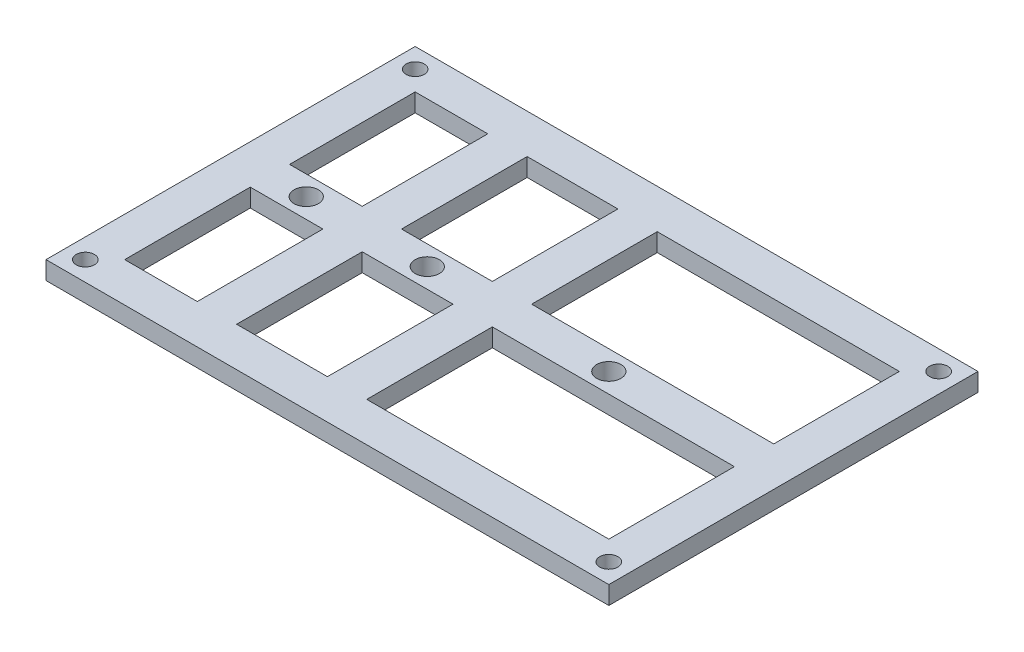
from build123d import *

# Parameters (mm, degrees)
SKETCH1_W           = 93
SKETCH1_H           = 61
SKETCH1_R           = 2
SKETCH1_R_2         = 1.5
SKETCH1_W_2         = 12
SKETCH1_H_2         = 20.75
SKETCH1_W_3         = 40
SKETCH1_W_4         = 15
BOSS_EXTRUDE1_DEPTH = 1.5


with BuildPart() as part:
    # Sketch1 → Boss-Extrude1 (new, symmetric)
    with BuildSketch(Plane(origin=(0, 0, 0), x_dir=(1, 0, 0), z_dir=(0, 1, 0))):
        Rectangle(SKETCH1_W, SKETCH1_H)
        with Locations(Location((-34, 0, 0), (0, 0, 270))):
            Circle(SKETCH1_R, mode=Mode.SUBTRACT)
        with Locations(Location((-14, 0, 0), (0, 0, 270))):
            Circle(SKETCH1_R, mode=Mode.SUBTRACT)
        with Locations(Location((16, 0, 0), (0, 0, 270))):
            Circle(SKETCH1_R, mode=Mode.SUBTRACT)
        with Locations(Location((43.25, -27.25, 0), (0, 0, 270))):
            Circle(SKETCH1_R_2, mode=Mode.SUBTRACT)
        with Locations(Location((-43.25, -27.25, 0), (0, 0, 270))):
            Circle(SKETCH1_R_2, mode=Mode.SUBTRACT)
        with Locations(Location((43.25, 27.25, 0), (0, 0, 90))):
            Circle(SKETCH1_R_2, mode=Mode.SUBTRACT)
        with Locations(Location((-43.25, 27.25, 0), (0, 0, 90))):
            Circle(SKETCH1_R_2, mode=Mode.SUBTRACT)
        with Locations((-34, -13.625)):
            Rectangle(SKETCH1_W_2, SKETCH1_H_2, mode=Mode.SUBTRACT)
        with Locations((-34, 13.625)):
            Rectangle(SKETCH1_W_2, SKETCH1_H_2, mode=Mode.SUBTRACT)
        with Locations((20, -13.625)):
            Rectangle(SKETCH1_W_3, SKETCH1_H_2, mode=Mode.SUBTRACT)
        with Locations((-14, 13.625)):
            Rectangle(SKETCH1_W_4, SKETCH1_H_2, mode=Mode.SUBTRACT)
        with Locations((20, 13.625)):
            Rectangle(SKETCH1_W_3, SKETCH1_H_2, mode=Mode.SUBTRACT)
        with Locations((-14, -13.625)):
            Rectangle(SKETCH1_W_4, SKETCH1_H_2, mode=Mode.SUBTRACT)
    extrude(amount=BOSS_EXTRUDE1_DEPTH, both=True)


solid = part.part
